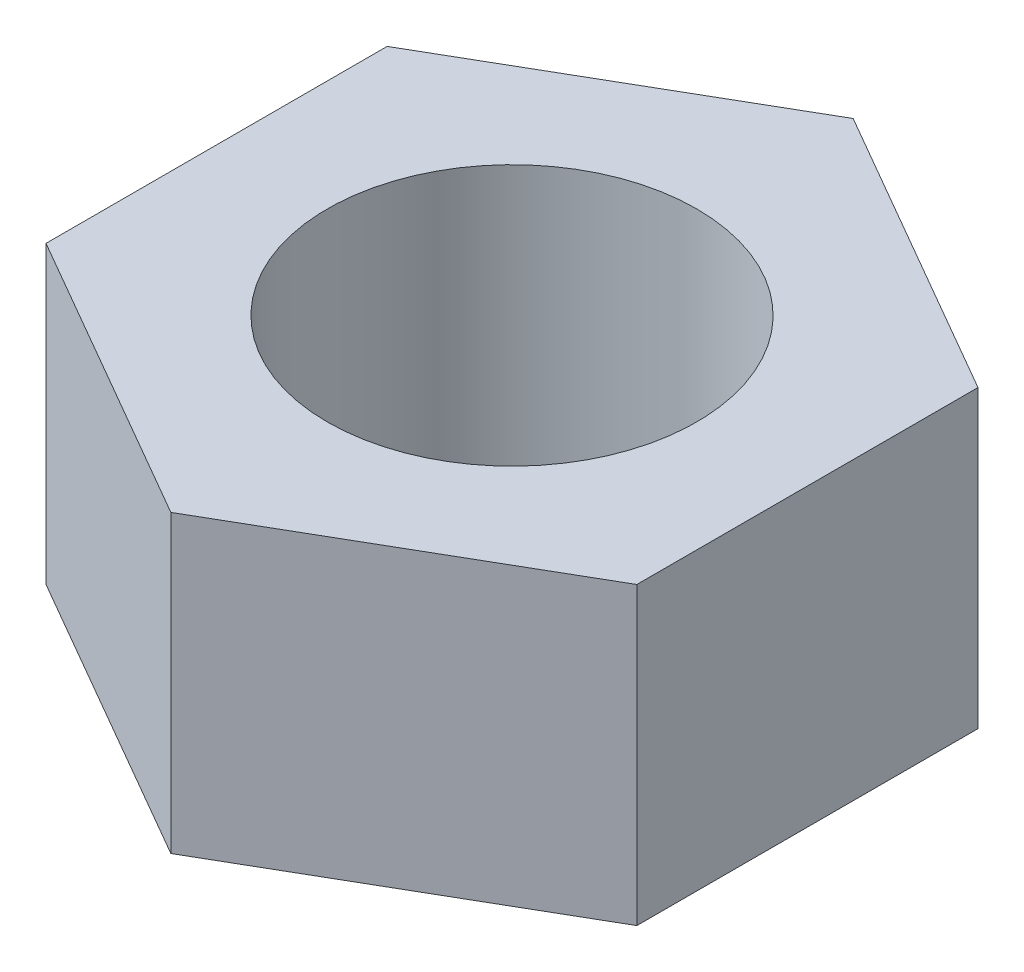
from build123d import *

# Parameters (mm, degrees)
SKETCH_1_R      = 2.5
EXTRUDE_1_DEPTH = 4


with BuildPart() as part:
    # Эскиз1 → Вытянуть1 (new body)
    with BuildSketch(Plane(origin=(0, 0, 0), x_dir=(1, 0, 0), z_dir=(0, 1, 0))):
        Polygon((0, -4.618802154), (4, -2.309401077), (4, 2.309401077), (0, 4.618802154), (-4, 2.309401077), (-4, -2.309401077), align=None)
        with Locations(Location((0, 0, 0), (0, 0, 270))):
            Circle(SKETCH_1_R, mode=Mode.SUBTRACT)
    extrude(amount=EXTRUDE_1_DEPTH)


solid = part.part
